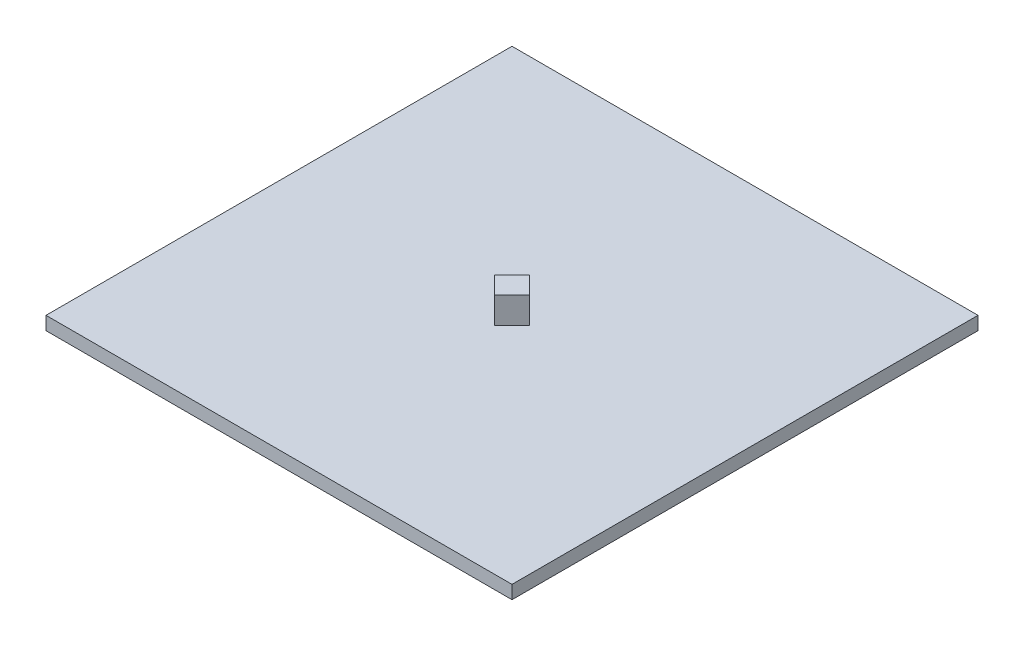
from build123d import *

# Parameters (mm, degrees)
SKETCH1_W           = 88.9
SKETCH1_H           = 88.9
BOSS_EXTRUDE1_DEPTH = 2.54
BOSS_EXTRUDE2_DEPTH = 5


with BuildPart() as part:
    # Sketch1 → Boss-Extrude1 (new body)
    with BuildSketch(Plane(origin=(0, 0, 0), x_dir=(1, 0, 0), z_dir=(0, 1, 0))):
        Rectangle(SKETCH1_W, SKETCH1_H)
    extrude(amount=BOSS_EXTRUDE1_DEPTH)

    # Sketch2 → Boss-Extrude2 (add)
    with BuildSketch(Plane(origin=(0, 2.54, 0), x_dir=(1, 0, 0), z_dir=(0, 1, 0))):
        Polygon((0, -3.358757211), (3.358757211, 0), (0, 3.358757211), (-3.358757211, 0), align=None)
    extrude(amount=BOSS_EXTRUDE2_DEPTH)


solid = part.part
